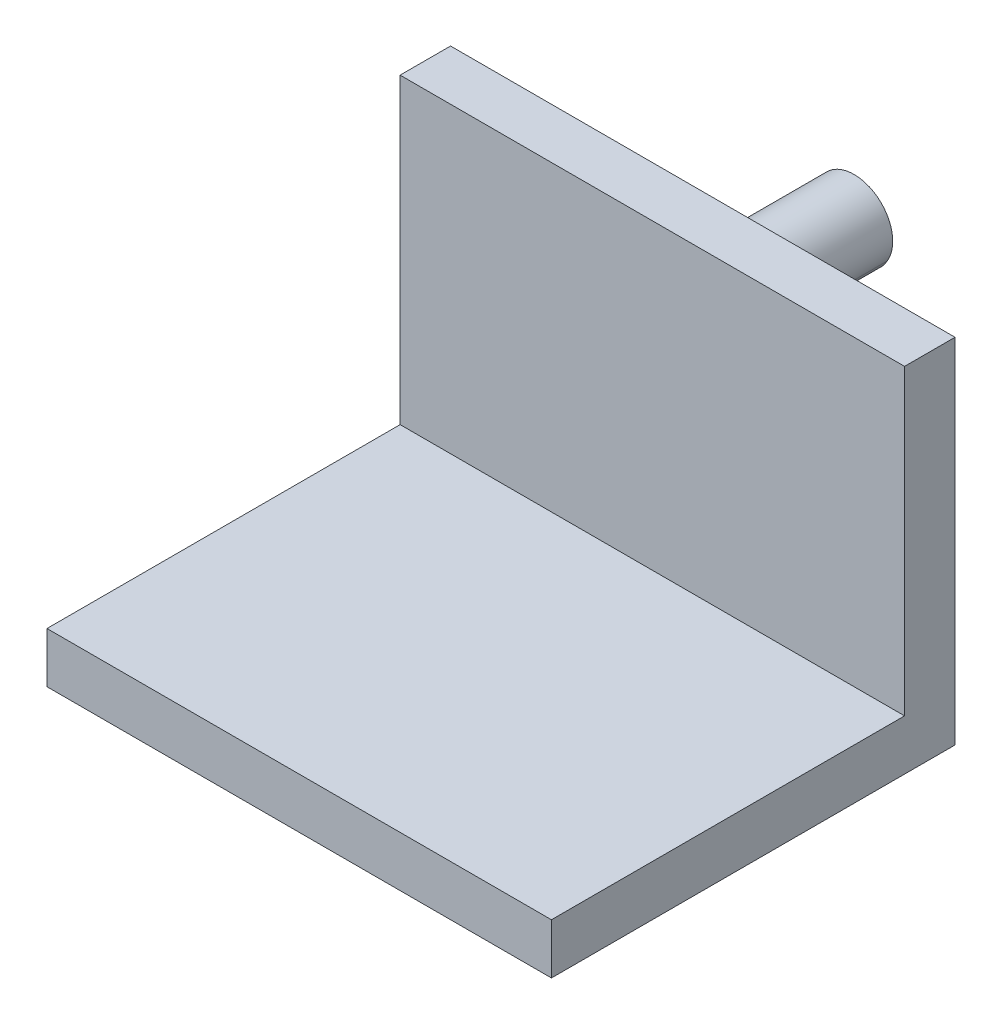
from build123d import *

# Parameters (mm, degrees)
SKETCH1_W           = 100
SKETCH1_H           = 70
BOSS_EXTRUDE1_DEPTH = 10
SKETCH2_W           = 70
SKETCH2_H           = 10
BOSS_EXTRUDE3_DEPTH = 100
SKETCH3_R           = 7.5
BOSS_EXTRUDE4_DEPTH = 30
SKETCH4_R           = 7.65
BOSS_EXTRUDE5_DEPTH = 30
SKETCH5_R           = 7.65
BOSS_EXTRUDE6_DEPTH = 30


with BuildPart() as part:
    # Sketch1 → Boss-Extrude1 (new body)
    with BuildSketch(Plane.XY):
        Rectangle(SKETCH1_W, SKETCH1_H)
    extrude(amount=BOSS_EXTRUDE1_DEPTH)

    # Sketch2 → Boss-Extrude3 (add)
    with BuildSketch(Plane.ZY.offset(50)):
        with Locations((45, -30)):
            Rectangle(SKETCH2_W, SKETCH2_H)
    extrude(amount=-BOSS_EXTRUDE3_DEPTH)

    # Sketch3 → Boss-Extrude4 (add)
    with BuildSketch(Plane(origin=(0, 0, 0), x_dir=(-1, 0, 0), z_dir=(0, 0, -1))):
        with Locations(Location((0, 15, 0), (0, 0, 180))):
            Circle(SKETCH3_R)
    extrude(amount=BOSS_EXTRUDE4_DEPTH)

    # Sketch4 → Boss-Extrude5 (add)
    with BuildSketch(Plane(origin=(0, 0, 0), x_dir=(-1, 0, 0), z_dir=(0, 0, -1))):
        with Locations((0, 15.3)):
            Circle(SKETCH4_R)
    extrude(amount=BOSS_EXTRUDE5_DEPTH)

    # Sketch5 → Boss-Extrude6 (add)
    with BuildSketch(Plane(origin=(0, 0, 0), x_dir=(-1, 0, 0), z_dir=(0, 0, -1))):
        with Locations((0.3, 15)):
            Circle(SKETCH5_R)
    extrude(amount=BOSS_EXTRUDE6_DEPTH)


solid = part.part
